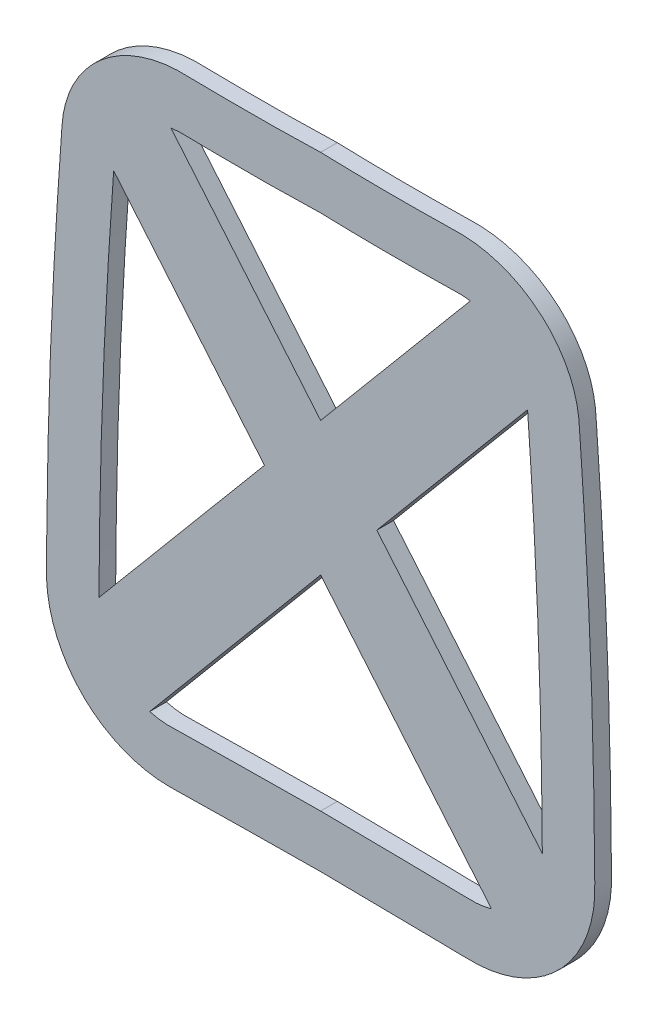
from build123d import *

# Parameters (mm, degrees)
EXTRUDE_1_DEPTH = 1.4


with BuildPart() as part:
    # Эскиз1 → Бобышка-Вытянуть1 (new, symmetric)
    # profile 1 of 6: a face of its own
    with BuildSketch(Plane.XY):
        with BuildLine():
            add(Edge.make_bspline(
                [(-0.000271802, 135.617334572), (-1.813454315, 135.562738575), (-5.440624227, 135.470060518), (-10.881538109, 135.414614087), (-15.416490606, 135.422674681), (-19.045824841, 135.465947417), (-21.311305675, 135.495675395), (-23.13012356, 135.549197816), (-25.035517279, 135.497691247), (-27.371332132, 135.198354863), (-30.120960798, 134.473188159), (-33.622985873, 133.021043754), (-37.570061525, 130.329041133), (-40.600819965, 126.596310531), (-42.266691884, 123.165401644), (-42.956926668, 120.876205269), (-43.28775905, 118.998054164), (-43.400819924, 117.575851218), (-43.493551559, 116.235576799), (-43.623077738, 114.415547368), (-43.780266513, 112.151175171), (-44.025689228, 108.521296979), (-44.317320376, 103.984582714), (-44.638155447, 98.53705888), (-45.021814715, 91.27097111), (-45.33259247, 84.000405374), (-45.569933543, 76.728002805), (-45.714606779, 71.272953744), (-45.828203254, 65.81805214), (-45.899157507, 61.270643018), (-45.942923982, 57.636153441), (-45.969486103, 54.900916967), (-45.986804271, 52.651442527), (-45.997349578, 50.785621578), (-45.797464886, 47.95047829), (-44.795474888, 43.780406809), (-42.001612467, 38.776010436), (-37.947743651, 34.722653189), (-32.934862859, 31.935399569), (-28.755746907, 30.95705109), (-25.925595728, 30.77400584), (-24.047190596, 30.795490625), (-21.807251956, 30.841673207), (-19.07231533, 30.888732902), (-15.443594648, 30.947261142), (-9.082991957, 31.035181513), (-3.633583554, 31.090598694), (6.33e-07, 31.123716916)],
                knots=[-0.000136523, -0.000136523, -0.000136523, -0.000136523, 0.031116437, 0.062369398, 0.093622358, 0.109248838, 0.124875318, 0.132688558, 0.140501798, 0.156128278, 0.171754759, 0.187381239, 0.218634199, 0.249887159, 0.265513639, 0.28114012, 0.28895336, 0.2967666, 0.30457984, 0.31239308, 0.32801956, 0.34364604, 0.374899, 0.406151961, 0.437404921, 0.499910842, 0.531163802, 0.562416762, 0.593669722, 0.624922683, 0.640549163, 0.656175643, 0.671802123, 0.679615363, 0.687428603, 0.718681564, 0.749934524, 0.781187484, 0.812440445, 0.843693405, 0.851506645, 0.859319885, 0.874946365, 0.890572845, 0.906199325, 0.937452286, 0.999958206, 0.999958206, 0.999958206, 0.999958206], degree=3))
            add(Edge.make_bspline(
                [(6.33e-07, 31.123716916), (3.633714449, 31.090603266), (9.083418232, 31.035171855), (15.444011562, 30.947237557), (19.073217268, 30.888752605), (21.807197955, 30.841523788), (24.05032904, 30.795828313), (25.926336035, 30.774012071), (28.756845071, 30.957220688), (32.937710455, 31.936295051), (37.949574342, 34.724364166), (42.00331871, 38.777393659), (44.796672961, 43.786088316), (45.798358274, 47.946539715), (45.996946459, 50.789300432), (45.989240512, 52.653594604), (45.968897154, 54.901715134), (45.94299812, 57.637894949), (45.899074921, 61.272347702), (45.828183804, 65.819987033), (45.714553058, 71.275062051), (45.569866562, 76.73031046), (45.332497201, 84.002971213), (45.021674347, 91.273790985), (44.637996339, 98.540147142), (44.317070662, 103.987826007), (44.025613895, 108.524787484), (43.779746303, 112.154742845), (43.623004241, 114.41918639), (43.493114937, 116.238927264), (43.40026662, 117.582224226), (43.287271003, 119.001736265), (42.955870779, 120.880247167), (42.266339225, 123.166591778), (40.600051218, 126.596815539), (37.576720848, 130.322512278), (33.62368785, 133.020943722), (30.122466193, 134.472603694), (27.372387913, 135.198212942), (25.036408806, 135.497560486), (23.131118127, 135.549216703), (21.312348444, 135.49570302), (19.046444479, 135.465951984), (15.417130176, 135.422665118), (10.882047305, 135.414763802), (5.440640774, 135.469486928), (1.813133212, 135.563964641), (-0.000271802, 135.617334572)],
                knots=[4.1792e-05, 4.1792e-05, 4.1792e-05, 4.1792e-05, 0.062547713, 0.093800673, 0.109427153, 0.125053633, 0.140680113, 0.148493353, 0.156306593, 0.187559553, 0.218812513, 0.250065474, 0.281318434, 0.312571394, 0.320384634, 0.328197874, 0.343824354, 0.359450834, 0.375077314, 0.406330274, 0.437583235, 0.468836195, 0.500089155, 0.562595075, 0.593848036, 0.625100996, 0.656353956, 0.671980436, 0.687606916, 0.695420156, 0.703233396, 0.711046636, 0.718859876, 0.734486356, 0.750112836, 0.781365797, 0.812618757, 0.828245237, 0.843871717, 0.859498197, 0.867311437, 0.875124677, 0.890751157, 0.906377637, 0.937630597, 0.968883558, 1.000136518, 1.000136518, 1.000136518, 1.000136518], degree=3))
        make_face()
        with BuildLine():
            Line((-34.717641115, 115.59028991), (-34.9048859, 115.813439555))
            Line((-34.9048859, 115.813439555), (-36.369128476, 125.532038055))
            Line((-36.369128476, 125.532038055), (-27.300616944, 129.202374057))
            Line((-27.300616944, 129.202374057), (-25.114220914, 126.596728734))
            add(Edge.make_bspline(
                [(0.002696214, 126.813439555), (-1.847032237, 126.757835365), (-5.546205931, 126.667213049), (-10.176204489, 126.622102521), (-13.873126864, 126.620430184), (-16.182614056, 126.633591024), (-18.028921917, 126.652249582), (-19.412399009, 126.670143649), (-20.56547329, 126.688218435), (-21.486995203, 126.704532907), (-22.065090934, 126.71561238), (-22.522374314, 126.724729381), (-22.871576855, 126.732088588), (-23.133209091, 126.736390467), (-23.374723363, 126.736618105), (-23.744365643, 126.727674089), (-24.300273751, 126.696112539), (-24.759732223, 126.647738816), (-25.075222992, 126.602506064), (-25.114220914, 126.596728734)],
                knots=[0.00136307, 0.00136307, 0.00136307, 0.00136307, 0.032583534, 0.063803999, 0.079414231, 0.095024463, 0.10282958, 0.110634696, 0.118439812, 0.12234237, 0.126244928, 0.128196207, 0.130147486, 0.132098765, 0.134050044, 0.137952602, 0.14185516, 0.149660277, 0.150763031, 0.150763031, 0.150763031, 0.150763031], degree=3))
            add(Edge.make_bspline(
                [(25.118988378, 126.59598393), (25.078626154, 126.601989108), (24.762510034, 126.647479156), (24.305663535, 126.695925932), (23.738632146, 126.727724172), (23.317076007, 126.738579744), (22.916337092, 126.733589112), (22.165387894, 126.717165487), (21.491157481, 126.704799203), (20.565326763, 126.688200645), (19.413674796, 126.670171304), (18.029617321, 126.652241863), (16.183164531, 126.633597682), (13.874269099, 126.620471444), (10.174607664, 126.621903147), (6.482558596, 126.659306177), (2.759566367, 126.733340093), (0.923743696, 126.786363283), (0.002696214, 126.813439555)],
                knots=[0.849195765, 0.849195765, 0.849195765, 0.849195765, 0.850339346, 0.858144458, 0.862047015, 0.865949571, 0.869852127, 0.873754683, 0.87765724, 0.881559796, 0.889364909, 0.897170021, 0.904975134, 0.920585359, 0.936195584, 0.967416034, 0.983026259, 0.998636484, 0.998636484, 0.998636484, 0.998636484], degree=3))
            Line((25.118988378, 126.59598393), (27.306009372, 129.202374057))
            Line((27.306009372, 129.202374057), (36.540384621, 124.000503677))
            Line((36.540384621, 124.000503677), (34.910278328, 115.813439555))
            Line((34.910278328, 115.813439555), (34.717960105, 115.584243622))
            add(Edge.make_bspline(
                [(37.18912782, 52.346489048), (37.186474863, 52.663205126), (37.177774654, 53.484758651), (37.171036497, 54.6927078), (37.15796427, 56.039570222), (37.139539233, 57.849738718), (37.112793904, 60.099414867), (37.074137646, 62.804548741), (37.013720114, 66.407441183), (36.883431371, 72.71019233), (36.6735316, 79.903909219), (36.392887616, 87.087946624), (36.145278278, 92.474411309), (35.862056155, 97.862841996), (35.59835478, 102.355069217), (35.372667025, 105.951833837), (35.196676142, 108.650250996), (35.044758442, 110.900710102), (34.920601666, 112.702138927), (34.826193261, 114.055314397), (34.758596516, 115.01409535), (34.722232931, 115.524341313), (34.717960105, 115.584243622)],
                knots=[0.329624976, 0.329624976, 0.329624976, 0.329624976, 0.335201917, 0.34300703, 0.350812142, 0.358617255, 0.37422748, 0.389837705, 0.40544793, 0.43666838, 0.499109281, 0.530329731, 0.561550181, 0.592770631, 0.623991082, 0.639601307, 0.655211532, 0.670821757, 0.67862687, 0.686431982, 0.694237095, 0.695274774, 0.695274774, 0.695274774, 0.695274774], degree=3))
            Line((37.18912782, 52.346489048), (39.985584797, 49.0138014))
            Line((39.985584797, 49.0138014), (38.683564685, 40.189457666))
            Line((38.683564685, 40.189457666), (30.73552546, 37.586243497))
            Line((30.73552546, 37.586243497), (28.665870484, 40.05276225))
            add(Edge.make_bspline(
                [(-6.333e-06, 39.924082369), (1.818939523, 39.907506512), (5.453788616, 39.874464365), (10.012453688, 39.82088601), (13.653203274, 39.772364791), (16.385745426, 39.733131176), (18.668331555, 39.696758126), (20.491715848, 39.665094181), (21.855803382, 39.640695286), (22.989619891, 39.620315494), (23.897545194, 39.603956149), (24.457171835, 39.594280632), (24.923126226, 39.585813112), (25.195768558, 39.581872011), (25.383242203, 39.581839695), (25.659021116, 39.586569164), (26.018083326, 39.601448511), (26.566595388, 39.642395689), (27.25092884, 39.727730784), (27.990922123, 39.871899868), (28.460519145, 39.993611304), (28.665870484, 40.05276225)],
                knots=[-0.000417923, -0.000417923, -0.000417923, -0.000417923, 0.030802527, 0.062022978, 0.077633203, 0.093243428, 0.108853653, 0.116658766, 0.124463878, 0.132268991, 0.136171547, 0.140074103, 0.142025381, 0.14397666, 0.145927938, 0.147879216, 0.151781772, 0.155684328, 0.163489441, 0.171294553, 0.177439203, 0.177439203, 0.177439203, 0.177439203], degree=3))
            add(Edge.make_bspline(
                [(-28.661675158, 40.0513356), (-28.457799904, 39.992704865), (-27.989476113, 39.871556643), (-27.247185858, 39.727549447), (-26.440427402, 39.625491053), (-25.711910197, 39.585058942), (-25.208408309, 39.579859369), (-24.714758814, 39.589490601), (-24.232050522, 39.598429664), (-23.776280394, 39.606244005), (-22.99436256, 39.620019891), (-21.852508016, 39.64083688), (-20.491798585, 39.665067481), (-18.667268581, 39.696795357), (-16.385232035, 39.733132381), (-13.652722609, 39.772366898), (-10.012113377, 39.8209092), (-5.453609014, 39.874444828), (-1.818888065, 39.907504216), (-6.333e-06, 39.924082369)],
                knots=[0.822600218, 0.822600218, 0.822600218, 0.822600218, 0.828705382, 0.836510498, 0.844315615, 0.852120731, 0.856023289, 0.859925847, 0.861877126, 0.863828405, 0.867730963, 0.875536079, 0.883341195, 0.891146311, 0.906756544, 0.922366776, 0.937977008, 0.969197473, 1.000417938, 1.000417938, 1.000417938, 1.000417938], degree=3))
            Line((-28.661675158, 40.0513356), (-30.730133032, 37.586243497))
            Line((-30.730133032, 37.586243497), (-37.483311953, 41.390416541))
            Line((-37.483311953, 41.390416541), (-39.980192369, 49.0138014))
            Line((-39.980192369, 49.0138014), (-37.18792002, 52.341502003))
            add(Edge.make_bspline(
                [(-34.717641115, 115.59028991), (-34.722056625, 115.528209988), (-34.757988996, 115.022181773), (-34.826816471, 114.046194628), (-34.920940359, 112.699543965), (-35.04513012, 110.897079598), (-35.19682568, 108.647443612), (-35.37285207, 105.948298562), (-35.598566942, 102.351952316), (-35.862216385, 97.859817629), (-36.145417658, 92.471613667), (-36.392999342, 87.085312672), (-36.673608735, 79.901569504), (-36.883483593, 72.707927776), (-37.013757094, 66.405743577), (-37.074171125, 62.802430298), (-37.112791909, 60.098956543), (-37.139627944, 57.845093156), (-37.158010612, 56.04203377), (-37.17035139, 54.68845717), (-37.179244853, 53.562977485), (-37.18516535, 52.775232106), (-37.187223162, 52.450225387), (-37.18792002, 52.341502003)],
                knots=[0.30467073, 0.30467073, 0.30467073, 0.30467073, 0.3057626, 0.313567716, 0.321372832, 0.329177948, 0.34478818, 0.360398413, 0.376008645, 0.40722911, 0.438449574, 0.469670039, 0.500890504, 0.563331433, 0.594551897, 0.61016213, 0.625772362, 0.641382594, 0.649187711, 0.656992827, 0.664797943, 0.668700501, 0.670552369, 0.670552369, 0.670552369, 0.670552369], degree=3))
        make_face(mode=Mode.SUBTRACT)
    # profile 2 of 6: a face of its own
    with BuildSketch(Plane.XY):
        with BuildLine():
            add(Edge.make_bspline(
                [(28.665870484, 40.05276225), (28.982205661, 40.143881818), (29.810805712, 40.420092633), (31.091959609, 41.012113673), (32.910257341, 42.179395506), (34.456392679, 43.705786937), (35.655166738, 45.517832641), (36.362638215, 46.990182054), (36.783371757, 48.300187515), (37.010073289, 49.36224021), (37.129401043, 50.197607501), (37.180528024, 50.863134919), (37.193447875, 51.410788985), (37.192676884, 51.883056794), (37.190187764, 52.219950554), (37.18912782, 52.346489048)],
                knots=[0.177439203, 0.177439203, 0.177439203, 0.177439203, 0.186904779, 0.202515004, 0.218125229, 0.249345679, 0.264955904, 0.280566129, 0.296176354, 0.303981467, 0.311786579, 0.319591692, 0.323494248, 0.327396805, 0.329624976, 0.329624976, 0.329624976, 0.329624976], degree=3))
            Line((28.665870484, 40.05276225), (30.73552546, 37.586243497))
            Line((30.73552546, 37.586243497), (38.683564685, 40.189457666))
            Line((38.683564685, 40.189457666), (39.985584797, 49.0138014))
            Line((39.985584797, 49.0138014), (37.18912782, 52.346489048))
        make_face()
    # profile 3 of 6: a face of its own
    with BuildSketch(Plane.XY):
        with BuildLine():
            Line((27.306009372, 129.202374057), (25.118988378, 126.59598393))
            add(Edge.make_bspline(
                [(34.717960105, 115.584243622), (34.706163478, 115.749624838), (34.678195665, 116.140761593), (34.63384377, 116.76158075), (34.584716224, 117.457116712), (34.559484188, 117.712115559), (34.506018128, 118.100792012), (34.423147039, 118.552644648), (34.279771906, 119.14037087), (33.975223157, 120.055846621), (33.45103027, 121.17392001), (32.602406276, 122.435314955), (31.205448982, 123.960466918), (29.443162888, 125.20207813), (27.434092816, 126.062947378), (26.136183388, 126.422282172), (25.354104551, 126.561002838), (25.118988378, 126.59598393)],
                knots=[0.695274774, 0.695274774, 0.695274774, 0.695274774, 0.698139651, 0.702042207, 0.705944764, 0.70984732, 0.713749876, 0.717652432, 0.725457545, 0.733262657, 0.748872883, 0.764483108, 0.780093333, 0.811313783, 0.826924008, 0.842534233, 0.849195765, 0.849195765, 0.849195765, 0.849195765], degree=3))
            Line((34.717960105, 115.584243622), (34.910278328, 115.813439555))
            Line((34.910278328, 115.813439555), (36.540384621, 124.000503677))
            Line((36.540384621, 124.000503677), (27.306009372, 129.202374057))
        make_face()
    # profile 4 of 6: a face of its own
    with BuildSketch(Plane.XY):
        with BuildLine():
            add(Edge.make_bspline(
                [(-37.18792002, 52.341502003), (-37.187957429, 52.335665551), (-37.188731163, 52.215023699), (-37.19033447, 51.969048367), (-37.193174741, 51.636873694), (-37.192861809, 51.356724036), (-37.180447283, 50.874793496), (-37.107119387, 49.906483538), (-36.866206285, 48.556344866), (-36.362180943, 46.989928028), (-35.654002185, 45.515584311), (-34.45575195, 43.705249342), (-32.908307672, 42.177903328), (-31.091525589, 41.011780371), (-29.807087964, 40.418776274), (-28.97908651, 40.142617208), (-28.661675158, 40.0513356)],
                knots=[0.670552369, 0.670552369, 0.670552369, 0.670552369, 0.67065178, 0.672603059, 0.674554338, 0.676505617, 0.680408175, 0.688213291, 0.703823524, 0.719433756, 0.735043988, 0.750654221, 0.781874685, 0.797484918, 0.81309515, 0.822600218, 0.822600218, 0.822600218, 0.822600218], degree=3))
            Line((-37.18792002, 52.341502003), (-39.980192369, 49.0138014))
            Line((-39.980192369, 49.0138014), (-37.483311953, 41.390416541))
            Line((-37.483311953, 41.390416541), (-30.730133032, 37.586243497))
            Line((-30.730133032, 37.586243497), (-28.661675158, 40.0513356))
        make_face()
    # profile 5 of 6: a face of its own
    with BuildSketch(Plane.XY):
        with BuildLine():
            add(Edge.make_bspline(
                [(-25.114220914, 126.596728734), (-25.351243831, 126.561615074), (-26.13312263, 126.422864515), (-27.433403712, 126.063336436), (-29.443037958, 125.20198214), (-31.202709371, 123.963092662), (-32.599928745, 122.43811078), (-33.452971781, 121.170632992), (-34.078648343, 119.835943001), (-34.380876044, 118.788057769), (-34.507316158, 118.090677447), (-34.548652062, 117.795303368), (-34.574103318, 117.561156321), (-34.58961645, 117.385790642), (-34.608878656, 117.122545496), (-34.641490435, 116.646092443), (-34.679035217, 116.131445088), (-34.706274719, 115.750095907), (-34.717641115, 115.59028991)],
                knots=[0.150763031, 0.150763031, 0.150763031, 0.150763031, 0.157465393, 0.173075625, 0.188685857, 0.219906322, 0.235516554, 0.251126787, 0.266737019, 0.282347251, 0.286249809, 0.290152367, 0.292103646, 0.294054925, 0.296006204, 0.297957483, 0.301860042, 0.30467073, 0.30467073, 0.30467073, 0.30467073], degree=3))
            Line((-34.717641115, 115.59028991), (-9.416763265, 85.437877836))
            Line((-9.416763265, 85.437877836), (-37.18792002, 52.341502003))
            add(Edge.make_bspline(
                [(-37.18792002, 52.341502003), (-37.187957429, 52.335665551), (-37.188731163, 52.215023699), (-37.19033447, 51.969048367), (-37.193174741, 51.636873694), (-37.192861809, 51.356724036), (-37.180447283, 50.874793496), (-37.107119387, 49.906483538), (-36.866206285, 48.556344866), (-36.362180943, 46.989928028), (-35.654002185, 45.515584311), (-34.45575195, 43.705249342), (-32.908307672, 42.177903328), (-31.091525589, 41.011780371), (-29.807087964, 40.418776274), (-28.97908651, 40.142617208), (-28.661675158, 40.0513356)],
                knots=[0.670552369, 0.670552369, 0.670552369, 0.670552369, 0.67065178, 0.672603059, 0.674554338, 0.676505617, 0.680408175, 0.688213291, 0.703823524, 0.719433756, 0.735043988, 0.750654221, 0.781874685, 0.797484918, 0.81309515, 0.822600218, 0.822600218, 0.822600218, 0.822600218], degree=3))
            Line((-28.661675158, 40.0513356), (0.002696214, 74.212203162))
            Line((0.002696214, 74.212203162), (28.665870484, 40.05276225))
            add(Edge.make_bspline(
                [(28.665870484, 40.05276225), (28.982205661, 40.143881818), (29.810805712, 40.420092633), (31.091959609, 41.012113673), (32.910257341, 42.179395506), (34.456392679, 43.705786937), (35.655166738, 45.517832641), (36.362638215, 46.990182054), (36.783371757, 48.300187515), (37.010073289, 49.36224021), (37.129401043, 50.197607501), (37.180528024, 50.863134919), (37.193447875, 51.410788985), (37.192676884, 51.883056794), (37.190187764, 52.219950554), (37.18912782, 52.346489048)],
                knots=[0.177439203, 0.177439203, 0.177439203, 0.177439203, 0.186904779, 0.202515004, 0.218125229, 0.249345679, 0.264955904, 0.280566129, 0.296176354, 0.303981467, 0.311786579, 0.319591692, 0.323494248, 0.327396805, 0.329624976, 0.329624976, 0.329624976, 0.329624976], degree=3))
            Line((37.18912782, 52.346489048), (9.422155693, 85.437877836))
            Line((9.422155693, 85.437877836), (34.717960105, 115.584243622))
            add(Edge.make_bspline(
                [(34.717960105, 115.584243622), (34.706163478, 115.749624838), (34.678195665, 116.140761593), (34.63384377, 116.76158075), (34.584716224, 117.457116712), (34.559484188, 117.712115559), (34.506018128, 118.100792012), (34.423147039, 118.552644648), (34.279771906, 119.14037087), (33.975223157, 120.055846621), (33.45103027, 121.17392001), (32.602406276, 122.435314955), (31.205448982, 123.960466918), (29.443162888, 125.20207813), (27.434092816, 126.062947378), (26.136183388, 126.422282172), (25.354104551, 126.561002838), (25.118988378, 126.59598393)],
                knots=[0.695274774, 0.695274774, 0.695274774, 0.695274774, 0.698139651, 0.702042207, 0.705944764, 0.70984732, 0.713749876, 0.717652432, 0.725457545, 0.733262657, 0.748872883, 0.764483108, 0.780093333, 0.811313783, 0.826924008, 0.842534233, 0.849195765, 0.849195765, 0.849195765, 0.849195765], degree=3))
            Line((25.118988378, 126.59598393), (0.002696214, 96.663552511))
            Line((0.002696214, 96.663552511), (-25.114220914, 126.596728734))
        make_face()
    # profile 6 of 6: a face of its own
    with BuildSketch(Plane.XY):
        with BuildLine():
            Line((-36.369128476, 125.532038055), (-34.9048859, 115.813439555))
            Line((-34.9048859, 115.813439555), (-34.717641115, 115.59028991))
            add(Edge.make_bspline(
                [(-25.114220914, 126.596728734), (-25.351243831, 126.561615074), (-26.13312263, 126.422864515), (-27.433403712, 126.063336436), (-29.443037958, 125.20198214), (-31.202709371, 123.963092662), (-32.599928745, 122.43811078), (-33.452971781, 121.170632992), (-34.078648343, 119.835943001), (-34.380876044, 118.788057769), (-34.507316158, 118.090677447), (-34.548652062, 117.795303368), (-34.574103318, 117.561156321), (-34.58961645, 117.385790642), (-34.608878656, 117.122545496), (-34.641490435, 116.646092443), (-34.679035217, 116.131445088), (-34.706274719, 115.750095907), (-34.717641115, 115.59028991)],
                knots=[0.150763031, 0.150763031, 0.150763031, 0.150763031, 0.157465393, 0.173075625, 0.188685857, 0.219906322, 0.235516554, 0.251126787, 0.266737019, 0.282347251, 0.286249809, 0.290152367, 0.292103646, 0.294054925, 0.296006204, 0.297957483, 0.301860042, 0.30467073, 0.30467073, 0.30467073, 0.30467073], degree=3))
            Line((-25.114220914, 126.596728734), (-27.300616944, 129.202374057))
            Line((-27.300616944, 129.202374057), (-36.369128476, 125.532038055))
        make_face()
    extrude(amount=EXTRUDE_1_DEPTH, both=True)


solid = part.part
